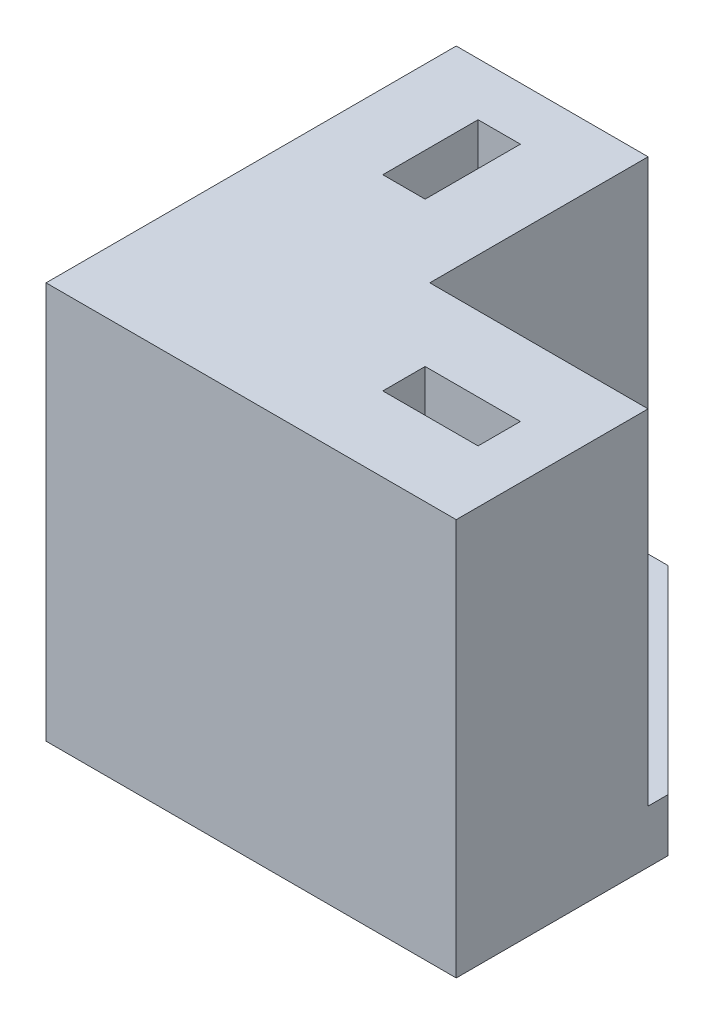
from build123d import *

# Parameters (mm, degrees)
SKETCH3_W           = 19.685
SKETCH3_H           = 19.685
BOSS_EXTRUDE2_DEPTH = 19.05
SKETCH5_R           = 2.54
CUT_EXTRUDE2_DEPTH  = 5.715
SKETCH6_W           = 10.4775
SKETCH6_H           = 10.4775
CUT_EXTRUDE3_DEPTH  = 16.51
SKETCH7_W           = 2.032
SKETCH7_H           = 4.572
SKETCH7_W_2         = 4.572
SKETCH7_H_2         = 2.032
CUT_EXTRUDE4_DEPTH  = 5.08
CHAMFER1_SIZE       = 9.525


with BuildPart() as part:
    # Sketch3 → Boss-Extrude2 (new body)
    with BuildSketch(Plane(origin=(0, 0, 0), x_dir=(1, 0, 0), z_dir=(0, 1, 0))):
        Rectangle(SKETCH3_W, SKETCH3_H)
    extrude(amount=BOSS_EXTRUDE2_DEPTH)

    # Sketch5 → Cut-Extrude2 (cut)
    with BuildSketch(Plane.XZ):
        with Locations(Location((-4.92125, 4.92125, 0), (0, 0, 270))):
            Circle(SKETCH5_R)
    extrude(amount=-CUT_EXTRUDE2_DEPTH, mode=Mode.SUBTRACT)

    # Sketch6 → Cut-Extrude3 (cut)
    with BuildSketch(Plane(origin=(0, 19.05, 0), x_dir=(1, 0, 0), z_dir=(0, 1, 0))):
        with Locations((4.60375, 4.60375)):
            Rectangle(SKETCH6_W, SKETCH6_H)
    extrude(amount=-CUT_EXTRUDE3_DEPTH, mode=Mode.SUBTRACT)

    # Sketch7 → Cut-Extrude4 (cut)
    with BuildSketch(Plane(origin=(0, 19.05, 0), x_dir=(1, 0, 0), z_dir=(0, 1, 0))):
        with Locations((-5.23875, 5.0165)):
            Rectangle(SKETCH7_W, SKETCH7_H)
        with Locations((5.0165, -5.23875)):
            Rectangle(SKETCH7_W_2, SKETCH7_H_2)
    extrude(amount=-CUT_EXTRUDE4_DEPTH, mode=Mode.SUBTRACT)

    # Chamfer1
    chamfer1_edges = [part.edges().sort_by_distance(p)[0] for p in [
        (9.8425, 1.27, -9.8425),
    ]]
    chamfer(chamfer1_edges, length=CHAMFER1_SIZE)


solid = part.part
